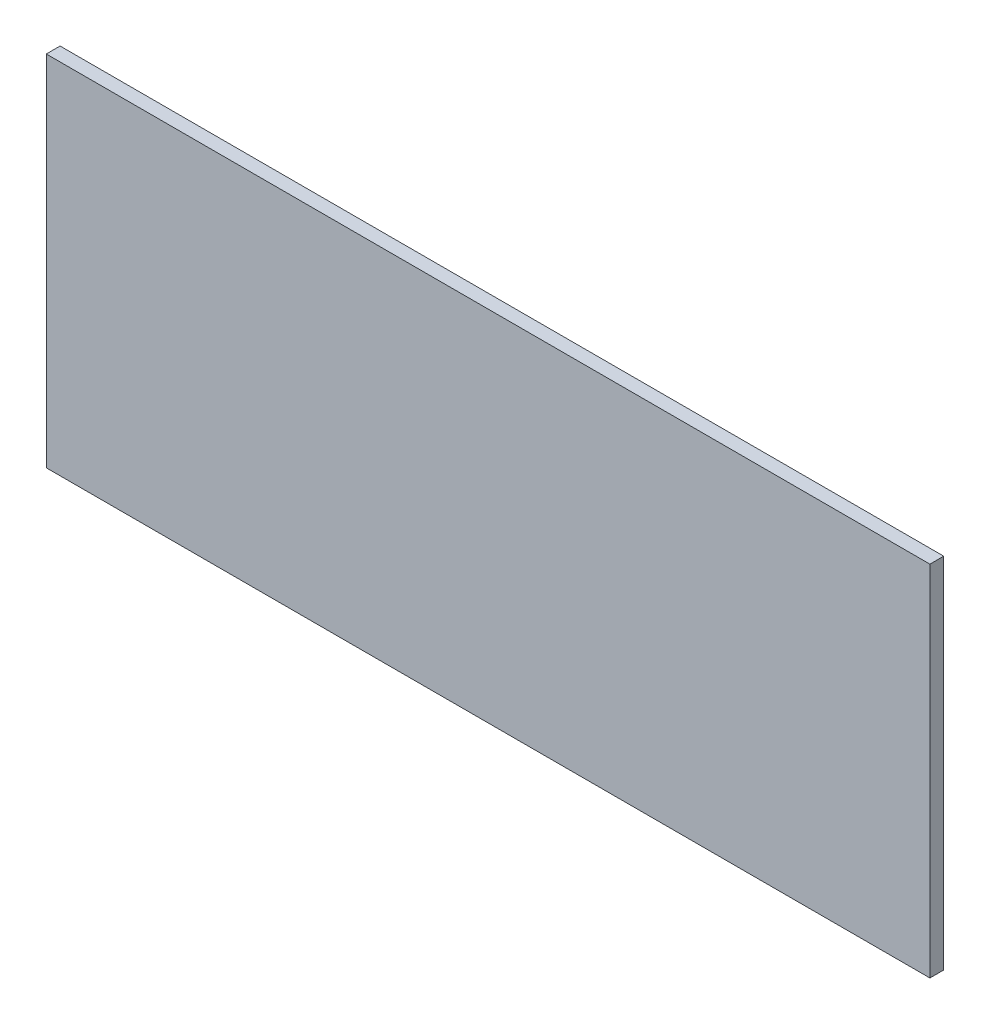
from build123d import *

# Parameters (mm, degrees)
CROQUIS1_W              = 160
CROQUIS1_H              = 64.9
SALIENTE_EXTRUIR1_DEPTH = 2.5


with BuildPart() as part:
    # Croquis1 → Saliente-Extruir1 (new body)
    with BuildSketch(Plane.XY):
        Rectangle(CROQUIS1_W, CROQUIS1_H)
    extrude(amount=SALIENTE_EXTRUIR1_DEPTH)


solid = part.part
